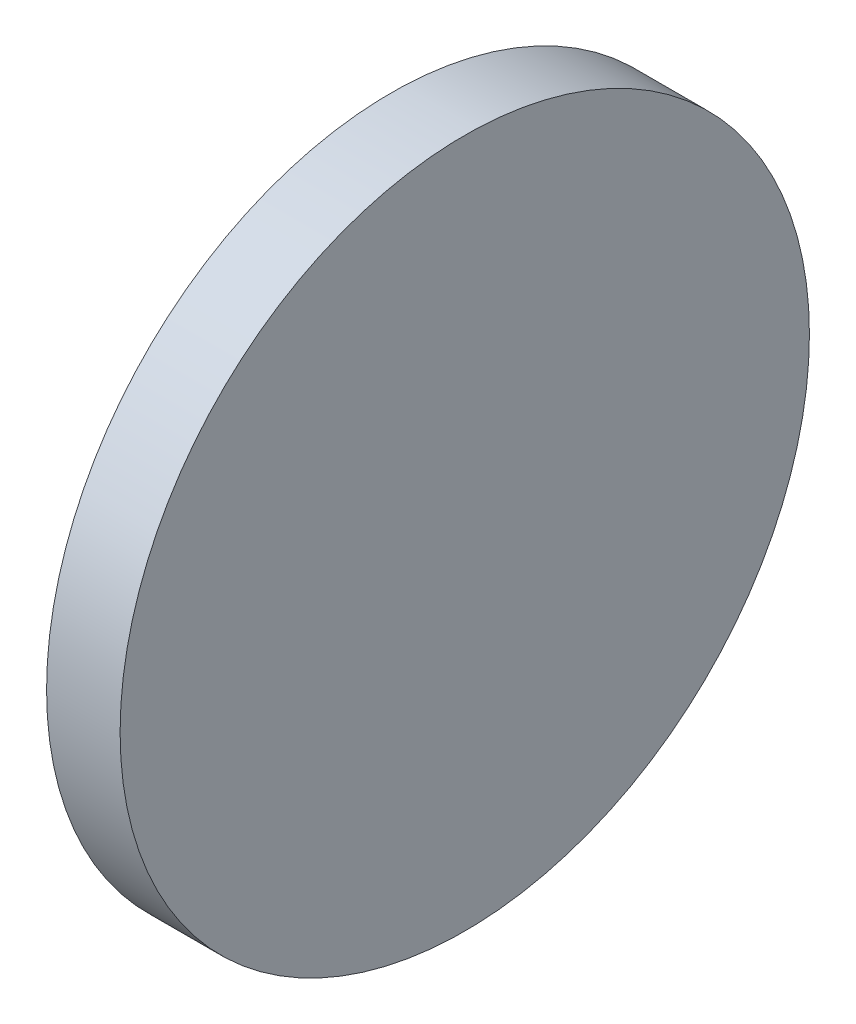
from build123d import *

# Parameters (mm, degrees)
BOARD_START = -71.8
SKETCH1_R   = 7.5
BOARD_DEPTH = 1.6


with BuildPart() as part:
    # Sketch1 → Board (new body)
    with BuildSketch(Plane(origin=(0, 0, 0), x_dir=(0, 0, -1), z_dir=(1, 0, 0)).offset(BOARD_START)):
        with Locations((0, 30)):
            Circle(SKETCH1_R)
    extrude(amount=BOARD_DEPTH)


solid = part.part
